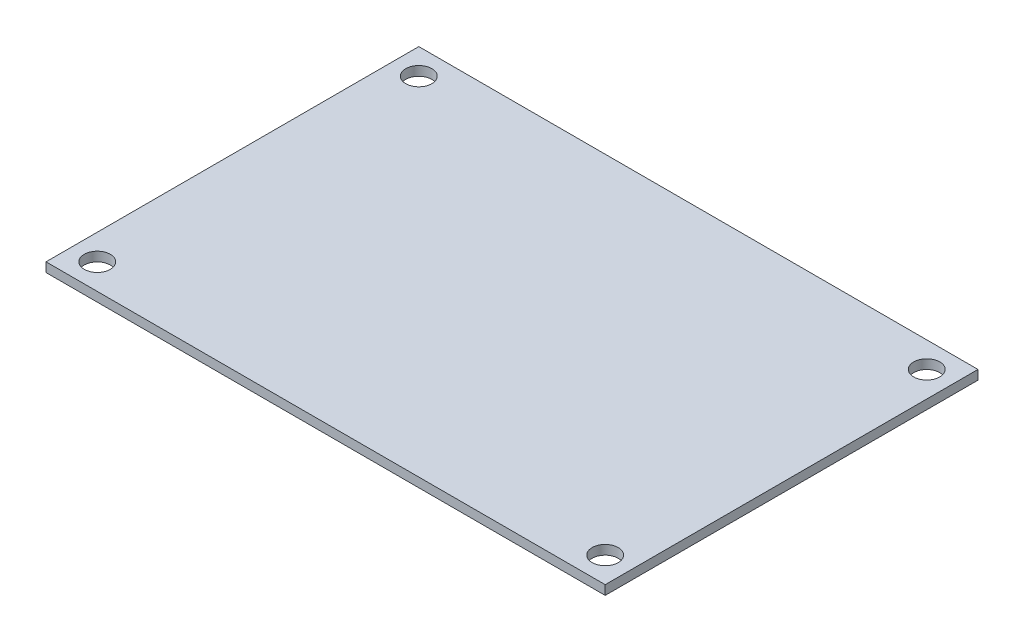
from build123d import *

# Parameters (mm, degrees)
SKETCH1_W           = 60
SKETCH1_H           = 40
BOSS_EXTRUDE1_DEPTH = 1
SKETCH2_R           = 1.4
CUT_EXTRUDE1_DEPTH  = 73.117958928


with BuildPart() as part:
    # Sketch1 → Boss-Extrude1 (new body)
    with BuildSketch(Plane(origin=(0, 0, 0), x_dir=(1, 0, 0), z_dir=(0, 1, 0))):
        with Locations((30, 20)):
            Rectangle(SKETCH1_W, SKETCH1_H)
    extrude(amount=BOSS_EXTRUDE1_DEPTH)

    # Sketch2 → Cut-Extrude1 (cut, through all)
    with BuildSketch(Plane(origin=(0, 1, 0), x_dir=(1, 0, 0), z_dir=(0, 1, 0))):
        with Locations(Location((2.75, 37.25, 0), (0, 0, 270))):
            Circle(SKETCH2_R)
        with Locations(Location((57.25, 37.25, 0), (0, 0, 270))):
            Circle(SKETCH2_R)
        with Locations(Location((57.25, 2.75, 0), (0, 0, 270))):
            Circle(SKETCH2_R)
        with Locations(Location((2.75, 2.75, 0), (0, 0, 270))):
            Circle(SKETCH2_R)
    extrude(amount=-CUT_EXTRUDE1_DEPTH, mode=Mode.SUBTRACT)


solid = part.part
